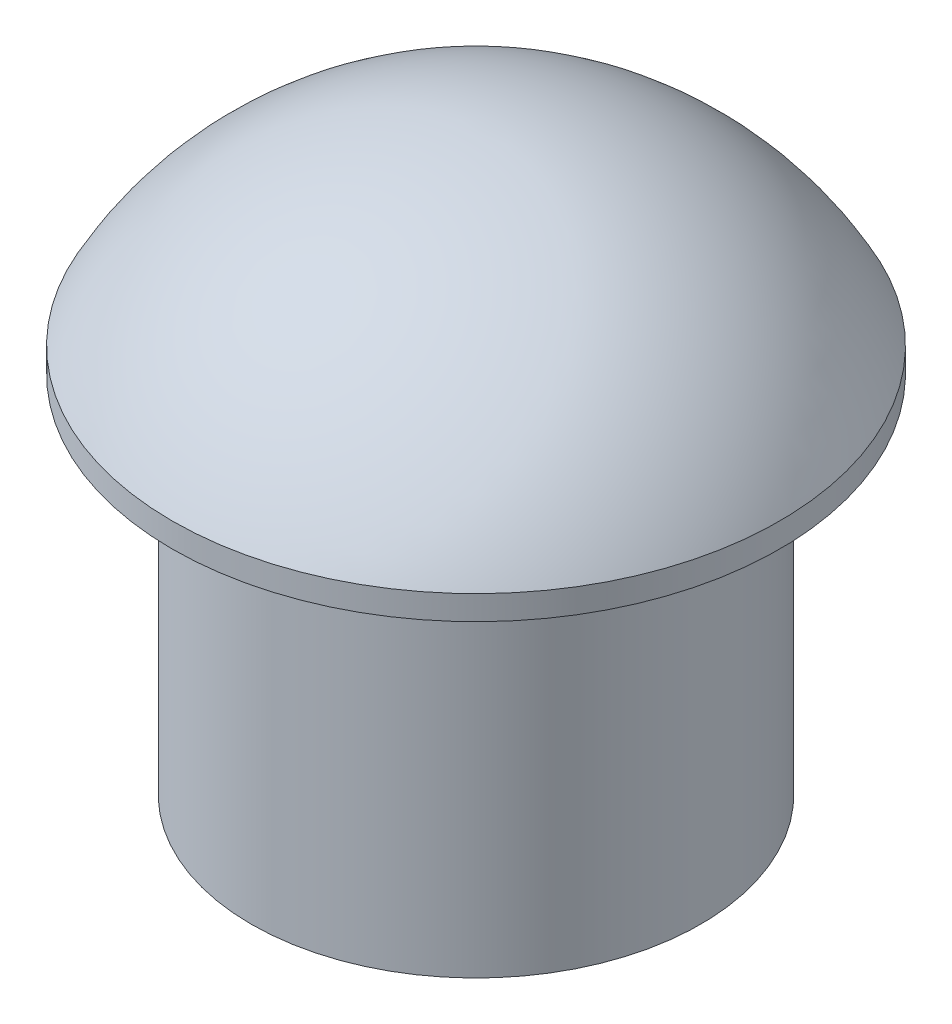
from build123d import *

# Parameters (mm, degrees)
SKETCH1_R           = 1.85
BOSS_EXTRUDE1_DEPTH = 3
SKETCH2_R           = 2.5
BOSS_EXTRUDE2_DEPTH = 0.2
DOME2_FACE_RADIUS   = 2.5
DOME2_HEIGHT        = 1.5


with BuildPart() as part:
    # Sketch1 → Boss-Extrude1 (new body)
    with BuildSketch(Plane(origin=(0, 0, 0), x_dir=(1, 0, 0), z_dir=(0, 1, 0))):
        with Locations(Location((0, 0, 0), (0, 0, 270))):
            Circle(SKETCH1_R)
    extrude(amount=BOSS_EXTRUDE1_DEPTH)

    # Sketch2 → Boss-Extrude2 (add)
    with BuildSketch(Plane(origin=(0, 3, 0), x_dir=(1, 0, 0), z_dir=(0, 1, 0))):
        with Locations(Location((0, 0, 0), (0, 0, 270))):
            Circle(SKETCH2_R)
    extrude(amount=BOSS_EXTRUDE2_DEPTH)

    # Dome2: a dome of height H over a round flat face of radius A is a cap of a sphere of radius (A * A + H * H) / (2 * H)
    dome2_r = (DOME2_FACE_RADIUS * DOME2_FACE_RADIUS + DOME2_HEIGHT * DOME2_HEIGHT) / (2 * DOME2_HEIGHT)
    dome2_base = Plane((0, 3.2, 0), z_dir=(0, 1, 0))
    with Locations(dome2_base.offset(DOME2_HEIGHT - dome2_r)):
        dome2_ball = Sphere(dome2_r, mode=Mode.PRIVATE)
    add(split(dome2_ball, bisect_by=dome2_base, keep=Keep.TOP, mode=Mode.PRIVATE))


solid = part.part
